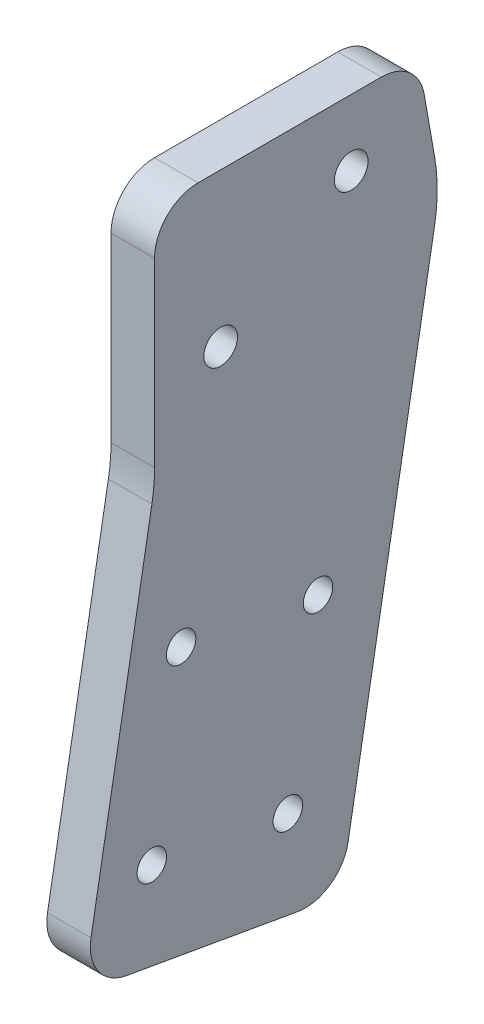
from build123d import *

# Parameters (mm, degrees)
BOSS_EXTRUDE1_DEPTH                               = 6.35
FILLET1_R                                         = 25.4
CSK_FOR_6_FLAT_HEAD_MACHINE_SCREW_100_D           = 4.3053
CSK_FOR_6_FLAT_HEAD_MACHINE_SCREW_100_CSINK_D     = 7.0866
CSK_FOR_6_FLAT_HEAD_MACHINE_SCREW_100_CSINK_ANGLE = 100
CSK_FOR_8_FLAT_HEAD_MACHINE_SCREW_100_D           = 4.9149
CSK_FOR_8_FLAT_HEAD_MACHINE_SCREW_100_CSINK_D     = 8.4328
CSK_FOR_8_FLAT_HEAD_MACHINE_SCREW_100_CSINK_ANGLE = 100
FILLET2_R                                         = 6.35


with BuildPart() as part:
    # Sketch1 → Boss-Extrude1 (new body)
    with BuildSketch(Plane.ZY.offset(-5.035827965)):
        Polygon((-147.77562455, 230.070458845), (-162.269800873, 312.271017517), (-159.04513305, 330.559017517), (-120.626834873, 330.559017517), (-120.626834873, 295.511176933), (-110.25444916, 236.686454414), align=None)
    extrude(amount=BOSS_EXTRUDE1_DEPTH)

    # Fillet1
    fillet1_edges = [part.edges().sort_by_distance(p)[0] for p in [
        (1.860827965, 312.271017517, -162.269800873),
        (1.860827965, 295.511176933, -120.626834873),
    ]]
    fillet(fillet1_edges, radius=FILLET1_R)

    # CSK for #6 Flat Head Machine Screw (100)1 (through all)
    with Locations(Plane.ZY.offset(1.314172035)):
        with Locations((-124.504125043, 273.139415456), (-144.485224025, 269.724179148), (-140.075144867, 244.324179148), (-120.227402214, 247.716621746)):
            CounterSinkHole(CSK_FOR_6_FLAT_HEAD_MACHINE_SCREW_100_D / 2, CSK_FOR_6_FLAT_HEAD_MACHINE_SCREW_100_CSINK_D / 2, counter_sink_angle=CSK_FOR_6_FLAT_HEAD_MACHINE_SCREW_100_CSINK_ANGLE)

    # CSK for #8 Flat Head Machine Screw (100)1 (through all)
    with Locations(Plane.ZY.offset(1.314172035)):
        with Locations((-149.328834873, 320.907017517), (-130.278834873, 308.207017517)):
            CounterSinkHole(CSK_FOR_8_FLAT_HEAD_MACHINE_SCREW_100_D / 2, CSK_FOR_8_FLAT_HEAD_MACHINE_SCREW_100_CSINK_D / 2, counter_sink_angle=CSK_FOR_8_FLAT_HEAD_MACHINE_SCREW_100_CSINK_ANGLE)

    # Fillet2
    fillet2_edges = [part.edges().sort_by_distance(p)[0] for p in [
        (1.860827965, 230.070458845, -147.77562455),
        (1.860827965, 330.559017517, -159.04513305),
        (1.860827965, 330.559017517, -120.626834873),
        (1.860827965, 236.686454414, -110.25444916),
    ]]
    fillet(fillet2_edges, radius=FILLET2_R)


solid = part.part
